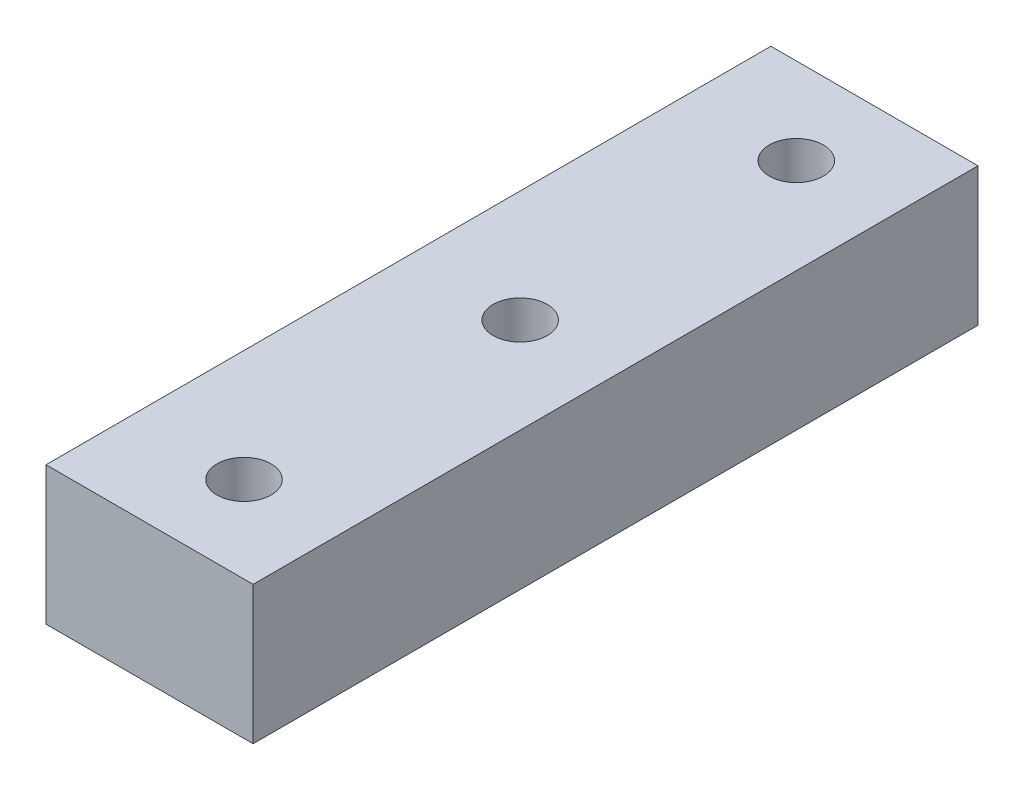
from build123d import *

# Parameters (mm, degrees)
BOSS_EXTRUDE1_DEPTH    = 12.7
F_10_CLEARANCE_HOLE1_D = 4.9784


with BuildPart() as part:
    # Sketch4 → Boss-Extrude1 (new body)
    with BuildSketch(Plane(origin=(0, 0, 0), x_dir=(1, 0, 0), z_dir=(0, 1, 0))):
        Polygon((-71.608792588, 6.232898137), (-71.608792588, 28.457898137), (-52.558792588, 28.457898137), (-52.558792588, -12.817101863), (-52.558792588, -38.217101863), (-71.608792588, -38.217101863), (-71.608792588, -12.817101863), align=None)
    extrude(amount=BOSS_EXTRUDE1_DEPTH)

    # #10 Clearance Hole1 (through all)
    with Locations(Plane(origin=(0, 12.7, 0), x_dir=(1, 0, 0), z_dir=(0, 1, 0))):
        with Locations((-61.333792588, 20.520398137), (-61.333792588, -4.879601863), (-61.333792588, -30.279601863)):
            Hole(F_10_CLEARANCE_HOLE1_D / 2)


solid = part.part
